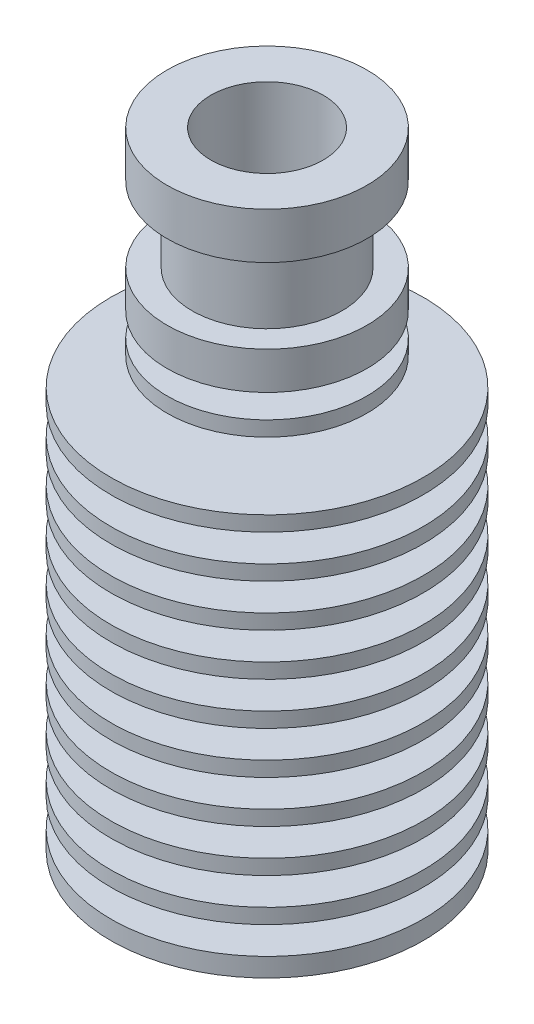
from build123d import *


with BuildPart() as part:
    # Skica1 → Rotovat1 (revolve)
    with BuildSketch(Plane.XY, mode=Mode.PRIVATE) as rotovat1_sk:
        Polygon((8, 64.637455621), (4.5, 64.637455621), (4.5, 52.97460351), (2, 50.637455621), (2, 46.936179321), (1, 46.637455621), (1, 33.037455621), (1, 31.837455621), (3, 31.837455621), (3, 14.537455621), (12.5, 14.537455621), (12.5, 16.037455621), (7.5, 16.037455621), (7.5, 18.237455621), (12.5, 18.237455621), (12.5, 19.437455621), (7.5, 19.437455621), (7.5, 21.637455621), (12.5, 21.637455621), (12.5, 22.837455621), (7.5, 22.837455621), (7.5, 25.037455621), (12.5, 25.037455621), (12.5, 26.237455621), (7.5, 26.237455621), (7.5, 28.437455621), (12.5, 28.437455621), (12.5, 29.637455621), (7.5, 29.637455621), (7.5, 31.837455621), (12.5, 31.837455621), (12.5, 33.037455621), (6.5, 33.037455621), (6.5, 35.237455621), (12.5, 35.237455621), (12.5, 36.437455621), (4, 36.437455621), (4, 38.637455621), (12.5, 38.637455621), (12.5, 39.837455621), (4, 39.837455621), (4, 42.037455621), (12.5, 42.037455621), (12.5, 43.237455621), (4, 43.237455621), (4, 45.437455621), (12.5, 45.437455621), (12.5, 46.637455621), (4, 46.637455621), (4, 48.837455621), (8, 48.837455621), (8, 50.037455621), (4.5, 50.037455621), (4.5, 51.937455621), (8, 51.937455621), (8, 54.937455621), (6, 54.937455621), (6, 60.937455621), (8, 60.937455621), align=None)
    revolve(rotovat1_sk.sketch.rotate(Axis((0, 64.637455621, 0), (0, -1, 0)), 180), axis=Axis((0, 64.637455621, 0), (0, -1, 0)))


solid = part.part
